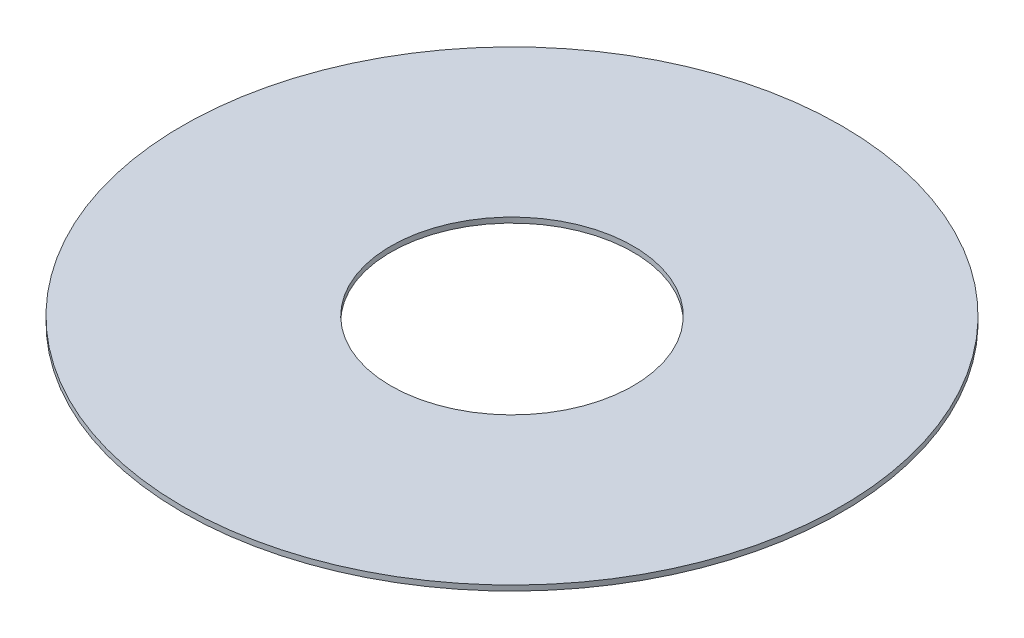
from build123d import *

# Parameters (mm, degrees)
SKETCH1_R           = 62.833006194
SKETCH1_R_2         = 23.1
BOSS_EXTRUDE1_DEPTH = 1


with BuildPart() as part:
    # Sketch1 → Boss-Extrude1 (new body)
    with BuildSketch(Plane(origin=(0, 0, 0), x_dir=(0.9995179941195831, 0, 0.031044797167406213), z_dir=(0, 1, 0))):
        with Locations(Location((-29.391570254, -2.611368154, 0), (0, 0, 271.779021696))):
            Circle(SKETCH1_R)
        with Locations(Location((-29.391570254, -2.611368154, 0), (0, 0, 271.779021696))):
            Circle(SKETCH1_R_2, mode=Mode.SUBTRACT)
    extrude(amount=BOSS_EXTRUDE1_DEPTH)


solid = part.part
